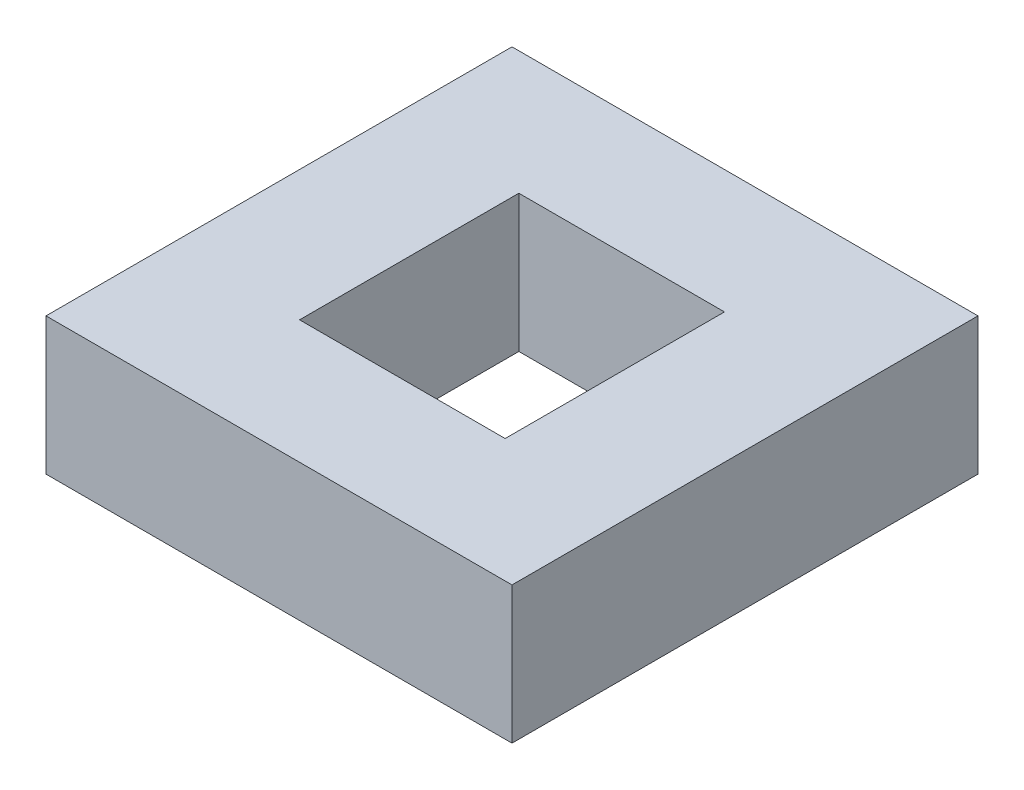
from build123d import *

# Parameters (mm, degrees)
SKETCH1_W           = 170
SKETCH1_H           = 170
BOSS_EXTRUDE1_DEPTH = 50
SKETCH2_W           = 75
SKETCH2_H           = 80
CUT_EXTRUDE1_DEPTH  = 50


with BuildPart() as part:
    # Sketch1 → Boss-Extrude1 (new body)
    with BuildSketch(Plane(origin=(0, 0, 0), x_dir=(1, 0, 0), z_dir=(0, 1, 0))):
        Rectangle(SKETCH1_W, SKETCH1_H)
    extrude(amount=BOSS_EXTRUDE1_DEPTH)

    # Sketch2 → Cut-Extrude1 (cut)
    with BuildSketch(Plane(origin=(0, 50, 0), x_dir=(1, 0, 0), z_dir=(0, 1, 0))):
        Rectangle(SKETCH2_W, SKETCH2_H)
    extrude(amount=-CUT_EXTRUDE1_DEPTH, mode=Mode.SUBTRACT)


solid = part.part
